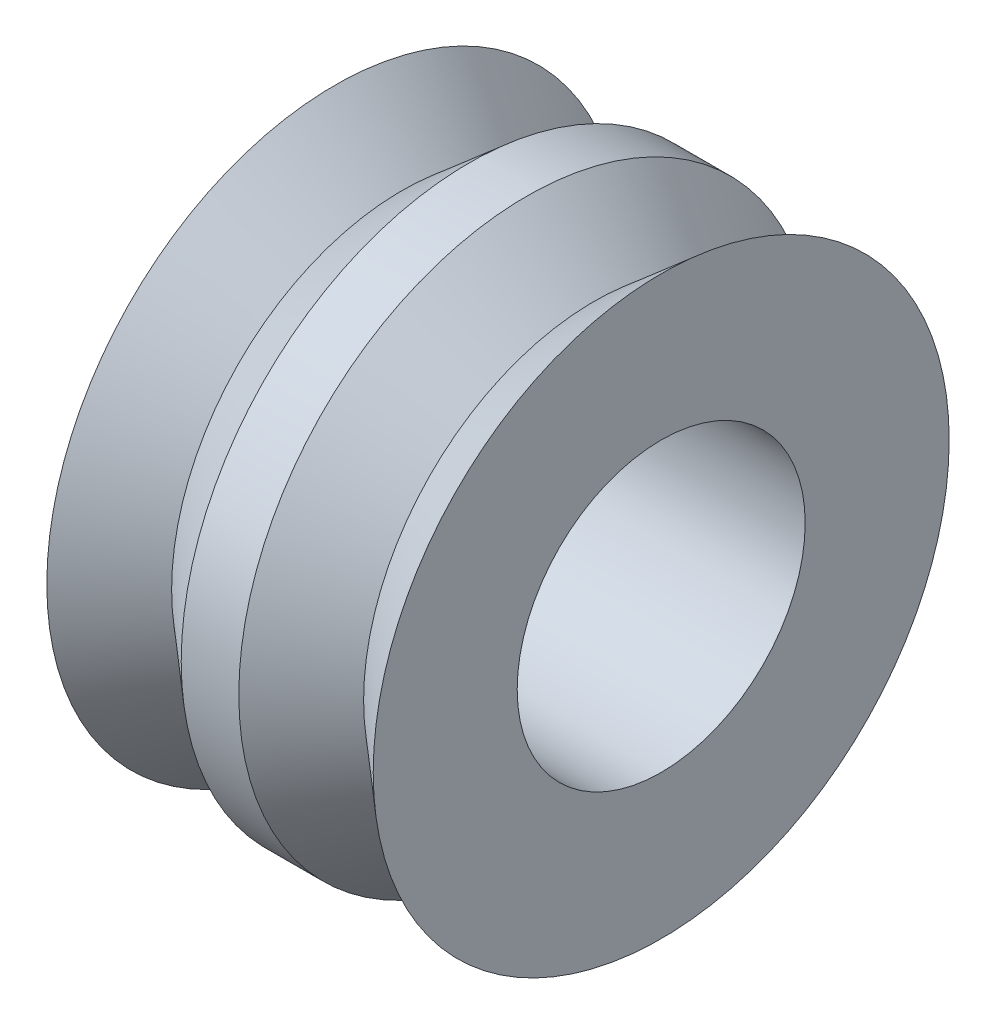
from build123d import *

# Parameters (mm, degrees)
F_15_0_15_DURCHMESSER_BOHRUNG2_D = 15


with BuildPart() as part:
    # Skizze1 → Rotation1 (revolve)
    with BuildSketch(Plane.XY, mode=Mode.PRIVATE) as rotation1_sk:
        Polygon((-8.5, 0), (-8.5, 15), (-5, 12), (-1.5, 15), (1.5, 15), (5, 12), (8.5, 15), (8.5, 0), align=None)
    revolve(rotation1_sk.sketch.rotate(Axis((-85.191280049, 0, 0), (1, 0, 0)), 90), axis=Axis((-85.191280049, 0, 0), (1, 0, 0)))

    # Ø15.0 (15) Durchmesser Bohrung2 (through all)
    with Locations(Plane.ZY.offset(8.5)):
        with Locations((0, 0)):
            Hole(F_15_0_15_DURCHMESSER_BOHRUNG2_D / 2)


solid = part.part
